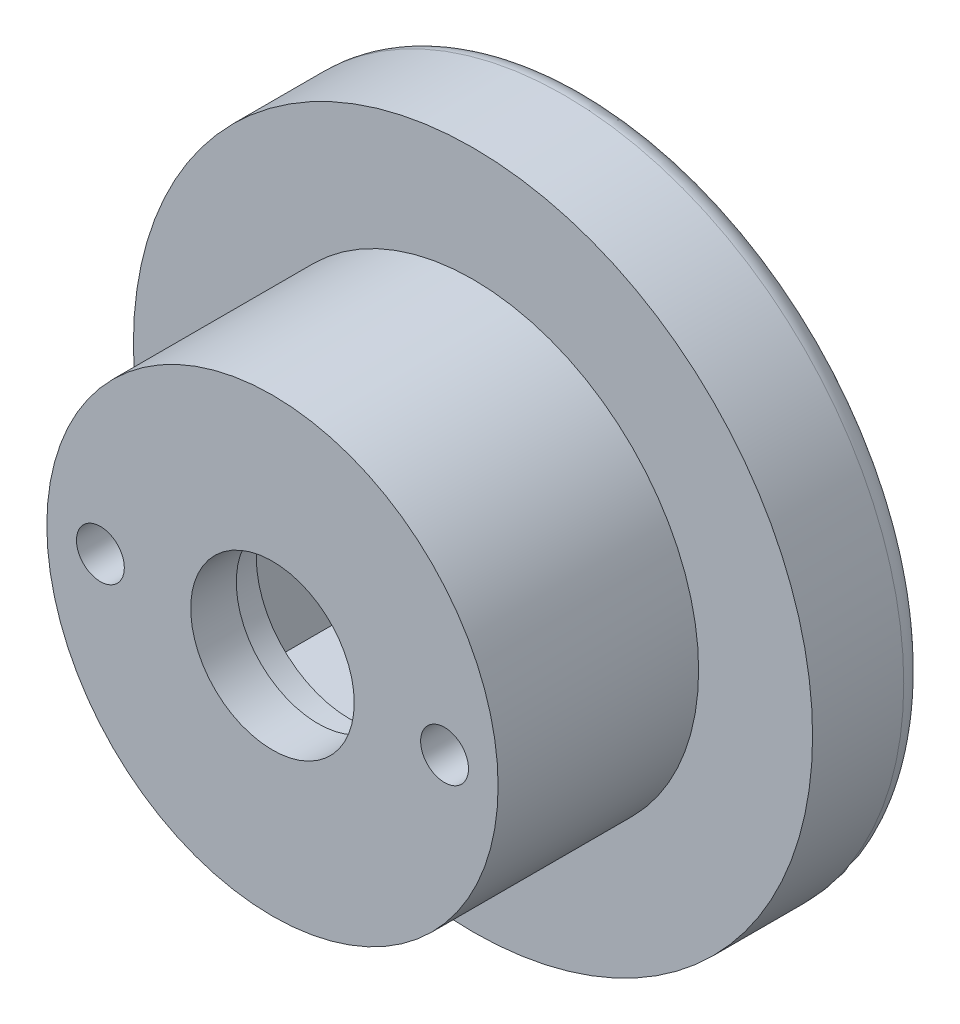
from build123d import *

# Parameters (mm, degrees)
SKETCH1_R               = 9.9
SKETCH1_R_2             = 4.1005
BOSS_EXTRUDE1_DEPTH     = 0.889
SKETCH2_R               = 9.9
SKETCH2_W               = 12.9
SKETCH2_H               = 13.2048
BOSS_EXTRUDE2_DEPTH     = 5.4086
SKETCH3_R               = 14.9
SKETCH3_W               = 12.9
SKETCH3_H               = 13.2048
BOSS_EXTRUDE3_DEPTH     = 5
CUT_EXTRUDE6_DEPTH      = 24.909323825
CUT_EXTRUDE6_DEPTH_BACK = 24.909323825
SKETCH4_R               = 1.05
BOSS_EXTRUDE4_START     = 0.5
SKETCH5_R               = 9.9
SKETCH5_R_2             = 4.1005
BOSS_EXTRUDE4_DEPTH     = 0.5
BOSS_EXTRUDE5_START     = 2
SKETCH6_R               = 9.9
SKETCH6_R_2             = 3.587456629
BOSS_EXTRUDE5_DEPTH     = 2
FILLET1_R               = 1
CUT_EXTRUDE7_DEPTH      = 26.187174628
CUT_EXTRUDE7_DEPTH_BACK = 26.187174628
SKETCH7_R               = 1.05


with BuildPart() as part:
    # Sketch1 → Boss-Extrude1 (new body)
    with BuildSketch(Plane.XY):
        Circle(SKETCH1_R)
        Circle(SKETCH1_R_2, mode=Mode.SUBTRACT)
    extrude(amount=-BOSS_EXTRUDE1_DEPTH)

    # Sketch2 → Boss-Extrude2 (add)
    with BuildSketch(Plane(origin=(0, 0, -0.889), x_dir=(-1, 0, 0), z_dir=(0, 0, -1))):
        with Locations(Location((0, 0, 0), (0, 0, 180))):
            Circle(SKETCH2_R)
        Rectangle(SKETCH2_W, SKETCH2_H, mode=Mode.SUBTRACT)
    extrude(amount=BOSS_EXTRUDE2_DEPTH)

    # Sketch3 → Boss-Extrude3 (add)
    with BuildSketch(Plane(origin=(0, 0, -6.2976), x_dir=(-1, 0, 0), z_dir=(0, 0, -1))):
        Circle(SKETCH3_R)
        Rectangle(SKETCH3_W, SKETCH3_H, mode=Mode.SUBTRACT)
    extrude(amount=BOSS_EXTRUDE3_DEPTH)

    # Sketch4 → Cut-Extrude6 (cut, two sides: drawn at the far end of the back side and taken through both)
    with BuildSketch(Plane.XY.offset(-CUT_EXTRUDE6_DEPTH_BACK)):
        with Locations((-7.549511775, 0.085860102)):
            Circle(SKETCH4_R)
        with Locations((7.55, 0)):
            Circle(SKETCH4_R)
    extrude(amount=CUT_EXTRUDE6_DEPTH + CUT_EXTRUDE6_DEPTH_BACK, mode=Mode.SUBTRACT)

    # Sketch5 → Boss-Extrude4 (add)
    with BuildSketch(Plane.XY.offset(BOSS_EXTRUDE4_START)):
        Circle(SKETCH5_R)
        Circle(SKETCH5_R_2, mode=Mode.SUBTRACT)
    extrude(amount=-BOSS_EXTRUDE4_DEPTH)

    # Sketch6 → Boss-Extrude5 (add)
    with BuildSketch(Plane.XY.offset(0.5).offset(BOSS_EXTRUDE5_START)):
        Circle(SKETCH6_R)
        Circle(SKETCH6_R_2, mode=Mode.SUBTRACT)
    extrude(amount=-BOSS_EXTRUDE5_DEPTH)

    # Fillet1
    fillet1_edges = [part.edges().sort_by_distance(p)[0] for p in [
        (14.9, 0, -11.2976),
    ]]
    fillet(fillet1_edges, radius=FILLET1_R)

    # Sketch7 → Cut-Extrude7 (cut, two sides: drawn at the far end of the back side and taken through both)
    with BuildSketch(Plane.XY.offset(2.5).offset(-CUT_EXTRUDE7_DEPTH_BACK)):
        with Locations((7.55, 0)):
            Circle(SKETCH7_R)
        with Locations((-7.549511775, 0.085860102)):
            Circle(SKETCH7_R)
    extrude(amount=CUT_EXTRUDE7_DEPTH + CUT_EXTRUDE7_DEPTH_BACK, mode=Mode.SUBTRACT)


solid = part.part
